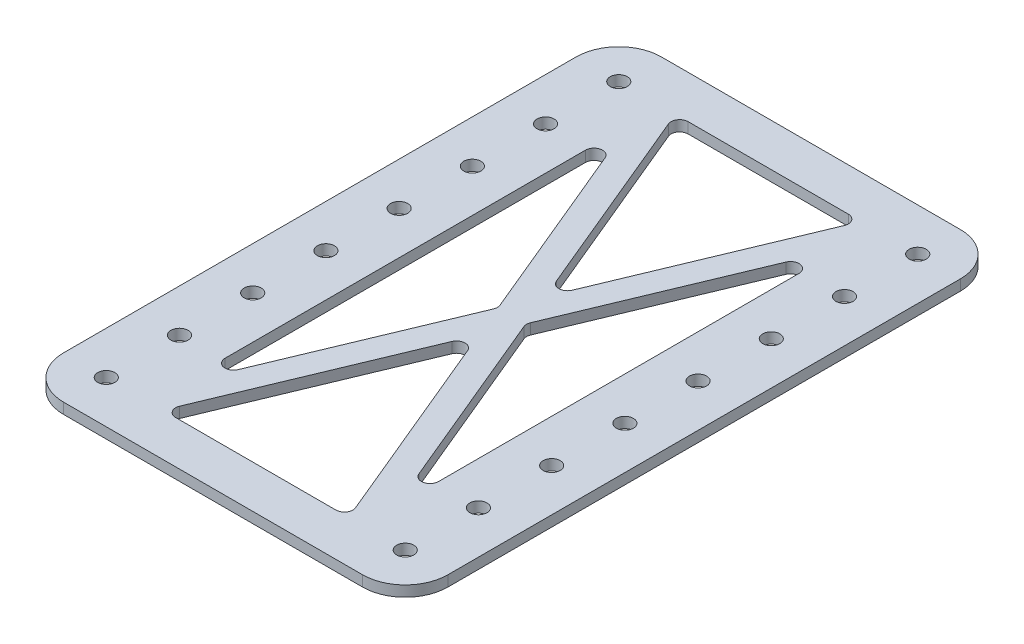
from build123d import *

# Parameters (mm, degrees)
SKETCH1_W           = 114.3
SKETCH1_H           = 177.8
BOSS_EXTRUDE1_DEPTH = 3.175
SKETCH2_R           = 2.54
CUT_EXTRUDE1_DEPTH  = 3.175
FILLET1_R           = 12.7
CUT_EXTRUDE2_DEPTH  = 106.732743864
FILLET2_R           = 2.54


with BuildPart() as part:
    # Sketch1 → Boss-Extrude1 (new body)
    with BuildSketch(Plane(origin=(0, 0, 0), x_dir=(1, 0, 0), z_dir=(0, 1, 0))):
        Rectangle(SKETCH1_W, SKETCH1_H)
    extrude(amount=BOSS_EXTRUDE1_DEPTH)

    # Sketch2 → Cut-Extrude1 (cut)
    with BuildSketch(Plane(origin=(0, 3.175, 0), x_dir=(1, 0, 0), z_dir=(0, 1, 0))):
        with Locations(Location((-44.45, 76.2, 0), (0, 0, 270))):
            Circle(SKETCH2_R)
        with Locations(Location((-44.45, 54.428571429, 0), (0, 0, 270))):
            Circle(SKETCH2_R)
        with Locations(Location((-44.45, 32.657142857, 0), (0, 0, 270))):
            Circle(SKETCH2_R)
        with Locations(Location((-44.45, 10.885714286, 0), (0, 0, 270))):
            Circle(SKETCH2_R)
        with Locations(Location((-44.45, -10.885714286, 0), (0, 0, 270))):
            Circle(SKETCH2_R)
        with Locations(Location((-44.45, -32.657142857, 0), (0, 0, 270))):
            Circle(SKETCH2_R)
        with Locations(Location((-44.45, -54.428571429, 0), (0, 0, 270))):
            Circle(SKETCH2_R)
        with Locations(Location((-44.45, -76.2, 0), (0, 0, 270))):
            Circle(SKETCH2_R)
        with Locations(Location((44.45, -76.2, 0), (0, 0, 90))):
            Circle(SKETCH2_R)
        with Locations(Location((44.45, -54.428571429, 0), (0, 0, 90))):
            Circle(SKETCH2_R)
        with Locations(Location((44.45, -32.657142857, 0), (0, 0, 90))):
            Circle(SKETCH2_R)
        with Locations(Location((44.45, -10.885714286, 0), (0, 0, 90))):
            Circle(SKETCH2_R)
        with Locations(Location((44.45, 10.885714286, 0), (0, 0, 90))):
            Circle(SKETCH2_R)
        with Locations(Location((44.45, 32.657142857, 0), (0, 0, 90))):
            Circle(SKETCH2_R)
        with Locations(Location((44.45, 54.428571429, 0), (0, 0, 90))):
            Circle(SKETCH2_R)
        with Locations(Location((44.45, 76.2, 0), (0, 0, 90))):
            Circle(SKETCH2_R)
    extrude(amount=-CUT_EXTRUDE1_DEPTH, mode=Mode.SUBTRACT)

    # Fillet1
    fillet1_edges = [part.edges().sort_by_distance(p)[0] for p in [
        (57.15, 1.5875, 88.9),
        (-57.15, 1.5875, 88.9),
        (-57.15, 1.5875, -88.9),
        (57.15, 1.5875, -88.9),
    ]]
    fillet(fillet1_edges, radius=FILLET1_R)

    # Sketch3 → Cut-Extrude2 (cut, through all)
    with BuildSketch(Plane(origin=(0, 3.175, 0), x_dir=(1, 0, 0), z_dir=(0, 1, 0))):
        Polygon((27.6225, -76.2), (-27.6225, -76.2), (0, -9.906), align=None)
        Polygon((31.75, -66.294), (31.75, 66.294), (4.1275, 0), align=None)
        Polygon((27.6225, 76.2), (-27.6225, 76.2), (0, 9.906), align=None)
        Polygon((-31.75, -66.294), (-31.75, 66.294), (-4.1275, 0), align=None)
    extrude(amount=-CUT_EXTRUDE2_DEPTH, mode=Mode.SUBTRACT)

    # Fillet2
    fillet2_edges = [part.edges().sort_by_distance(p)[0] for p in [
        (31.75, 1.5875, 66.294),
        (4.1275, 1.5875, 0),
        (31.75, 1.5875, -66.294),
        (-4.1275, 1.5875, 0),
        (-31.75, 1.5875, 66.294),
        (-31.75, 1.5875, -66.294),
        (0, 1.5875, -9.906),
        (-27.6225, 1.5875, -76.2),
        (27.6225, 1.5875, -76.2),
        (0, 1.5875, 9.906),
        (27.6225, 1.5875, 76.2),
        (-27.6225, 1.5875, 76.2),
    ]]
    fillet(fillet2_edges, radius=FILLET2_R)


solid = part.part
